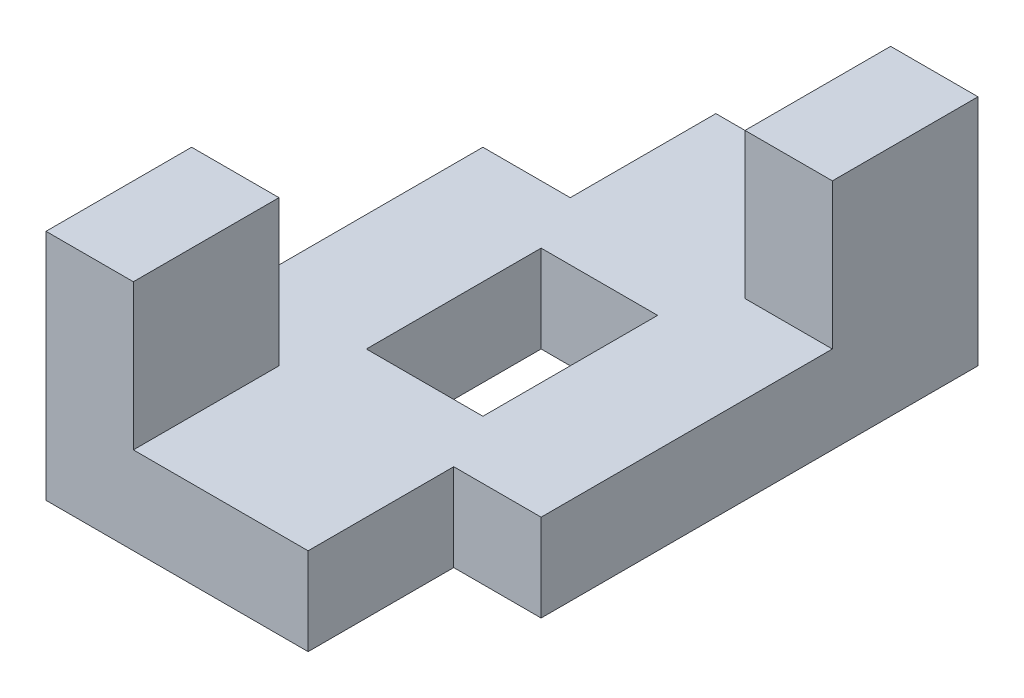
from build123d import *

# Parameters (mm, degrees)
SKETCH1_W           = 20
SKETCH1_H           = 30
BOSS_EXTRUDE1_DEPTH = 15
SKETCH1_3_W         = 15
SKETCH1_3_H         = 25
BOSS_EXTRUDE2_DEPTH = 40


with BuildPart() as part:
    # Sketch1 → Boss-Extrude1 (new body)
    with BuildSketch(Plane(origin=(0, 0, 0), x_dir=(1, 0, 0), z_dir=(0, 1, 0))):
        Polygon((-30, 0), (0, 0), (0, 25), (15, 25), (15, 75), (0, 75), (0, 100), (-30, 100), (-30, 75), (-45, 75), (-45, 25), (-30, 25), align=None)
        with Locations((-15, 50)):
            Rectangle(SKETCH1_W, SKETCH1_H, mode=Mode.SUBTRACT)
    extrude(amount=BOSS_EXTRUDE1_DEPTH)

    # Sketch1<3> → Boss-Extrude2 (add)
    with BuildSketch(Plane(origin=(0, 0, 0), x_dir=(1, 0, 0), z_dir=(0, 1, 0))):
        with Locations((-37.5, 12.5)):
            Rectangle(SKETCH1_3_W, SKETCH1_3_H)
        with Locations((7.5, 87.5)):
            Rectangle(SKETCH1_3_W, SKETCH1_3_H)
    extrude(amount=BOSS_EXTRUDE2_DEPTH)


solid = part.part
